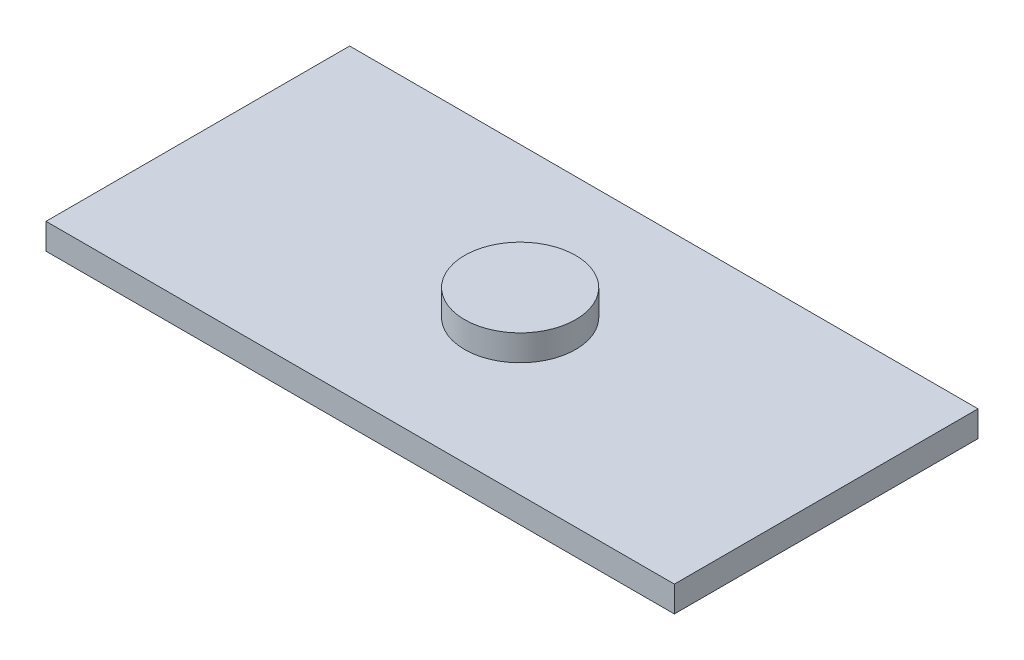
from build123d import *

# Parameters (mm, degrees)
SKETCH1_W           = 60.675127928
SKETCH1_H           = 29.319524905
BOSS_EXTRUDE1_DEPTH = 2.5
SKETCH2_R           = 5.369219063
BOSS_EXTRUDE2_DEPTH = 2.5


with BuildPart() as part:
    # Sketch1 → Boss-Extrude1 (new body)
    with BuildSketch(Plane(origin=(0, 0, 0), x_dir=(1, 0, 0), z_dir=(0, 1, 0))):
        with Locations((30.337563964, 14.659762453)):
            Rectangle(SKETCH1_W, SKETCH1_H)
    extrude(amount=BOSS_EXTRUDE1_DEPTH)

    # Sketch2 → Boss-Extrude2 (add)
    with BuildSketch(Plane(origin=(0, 2.5, 0), x_dir=(1, 0, 0), z_dir=(0, 1, 0))):
        with Locations(Location((30.927109659, 14.856277684, 0), (0, 0, 270))):
            Circle(SKETCH2_R)
    extrude(amount=BOSS_EXTRUDE2_DEPTH)


solid = part.part
